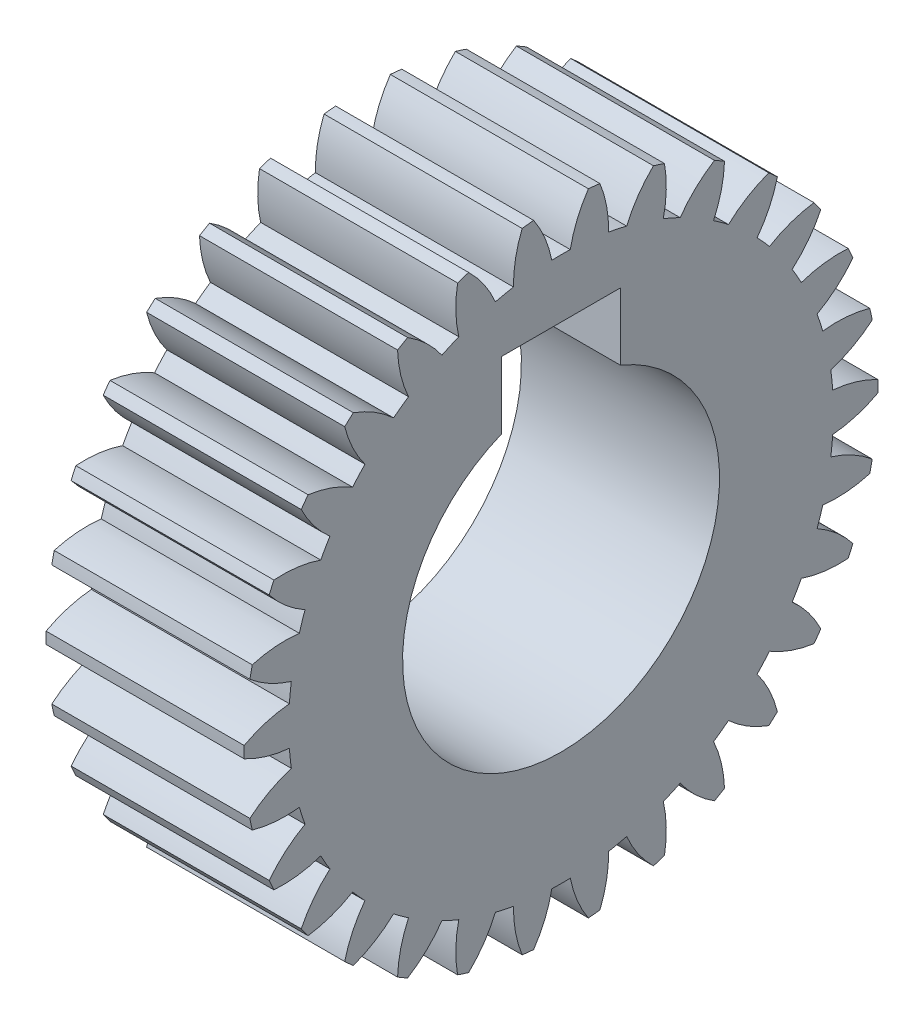
from build123d import *

# Parameters (mm, degrees)
BASPROSKE_W     = 5
BASPROSKE_H     = 8
TOOTHCUT_DEPTH  = 13.369316877
TEETHCUTS_COUNT = 30
TEETHCUTS_ANGLE = 348
BORSKE_R        = 4
BORE_DEPTH      = 50.0000508
KEYSKE_W        = 3
KEYSKE_H        = 5.4
KEYWAY_DEPTH    = 50.0000508


with BuildPart() as part:
    # BasProSke → Base-Revolve (revolve)
    with BuildSketch(Plane(origin=(0, 0, 0), x_dir=(1, 0, 0), z_dir=(0, 1, 0)), mode=Mode.PRIVATE) as base_revolve_sk:
        with Locations((2.5, 4)):
            Rectangle(BASPROSKE_W, BASPROSKE_H)
    revolve(base_revolve_sk.sketch.rotate(Axis((-10, 0, 0), (1, 0, 0)), 180), axis=Axis((-10, 0, 0), (1, 0, 0)))

    # TooCutSke → ToothCut (cut, through all)
    with BuildSketch(Plane(origin=(0, 0, 0), x_dir=(0, 0, -1), z_dir=(1, 0, 0))):
        with BuildLine():
            ThreePointArc((0.233102578, 6.87004652), (0, 6.874), (-0.233102578, 6.87004652))
            ThreePointArc((-0.233102578, 6.87004652), (-0.41229689, 7.456465027), (-0.706981715, 7.994199273))
            ThreePointArc((-0.706981715, 7.994199273), (0, 8.0254), (0.706981715, 7.994199273))
            ThreePointArc((0.706981715, 7.994199273), (0.41229689, 7.456465027), (0.233102578, 6.87004652))
        make_face()
    toothcut = extrude(amount=TOOTHCUT_DEPTH, mode=Mode.SUBTRACT)

    # TeethCuts: ToothCut ×30 about axis
    teethcuts_axis = Axis((-10, 0, 0), (1, 0, 0))
    for i in range(1, TEETHCUTS_COUNT):
        add(toothcut.rotate(teethcuts_axis, i * TEETHCUTS_ANGLE / (TEETHCUTS_COUNT - 1)), mode=Mode.SUBTRACT)

    # BorSke → Bore (cut, symmetric)
    with BuildSketch(Plane(origin=(0, 0, 0), x_dir=(0, 0, -1), z_dir=(1, 0, 0))):
        with Locations(Location((0, 0, 0), (0, 0, 180))):
            Circle(BORSKE_R)
    extrude(amount=BORE_DEPTH, both=True, mode=Mode.SUBTRACT)

    # KeySke → Keyway (cut, symmetric)
    with BuildSketch(Plane(origin=(0, 0, 0), x_dir=(0, 0, -1), z_dir=(1, 0, 0))):
        with Locations((0, 2.7)):
            Rectangle(KEYSKE_W, KEYSKE_H)
    extrude(amount=KEYWAY_DEPTH, both=True, mode=Mode.SUBTRACT)


solid = part.part
